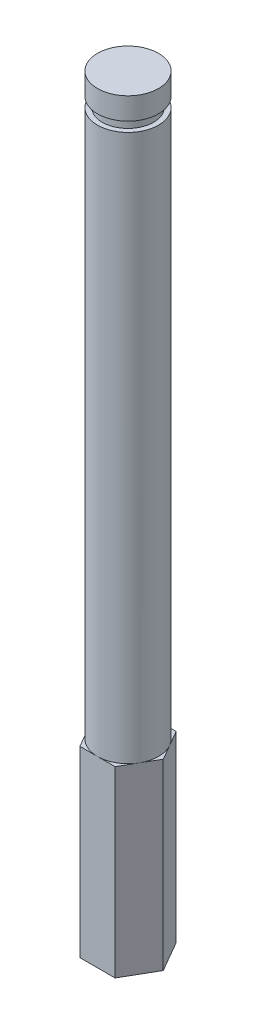
from build123d import *

# Parameters (mm, degrees)
BOSS_EXTRUDE1_DEPTH = 19.05
SKETCH2_R           = 3.175
BOSS_EXTRUDE2_DEPTH = 56.896
SKETCH3_R           = 2.667
BOSS_EXTRUDE3_DEPTH = 1.016
SKETCH4_R           = 3.175
BOSS_EXTRUDE4_DEPTH = 2.286


with BuildPart() as part:
    # Sketch1 → Boss-Extrude1 (new body)
    with BuildSketch(Plane(origin=(0, 0, 0), x_dir=(1, 0, 0), z_dir=(0, 1, 0))):
        Polygon((1.833087105, 3.175), (-1.833087105, 3.175), (-3.666174209, 0), (-1.833087105, -3.175), (1.833087105, -3.175), (3.666174209, 0), align=None)
    extrude(amount=BOSS_EXTRUDE1_DEPTH)

    # Sketch2 → Boss-Extrude2 (add)
    with BuildSketch(Plane(origin=(0, 19.05, 0), x_dir=(1, 0, 0), z_dir=(0, 1, 0))):
        with Locations(Location((0, 0, 0), (0, 0, 270))):
            Circle(SKETCH2_R)
    extrude(amount=BOSS_EXTRUDE2_DEPTH)

    # Sketch3 → Boss-Extrude3 (add)
    with BuildSketch(Plane(origin=(0, 75.946, 0), x_dir=(1, 0, 0), z_dir=(0, 1, 0))):
        with Locations(Location((0, 0, 0), (0, 0, 270))):
            Circle(SKETCH3_R)
    extrude(amount=BOSS_EXTRUDE3_DEPTH)

    # Sketch4 → Boss-Extrude4 (add)
    with BuildSketch(Plane(origin=(0, 76.962, 0), x_dir=(1, 0, 0), z_dir=(0, 1, 0))):
        with Locations(Location((0, 0, 0), (0, 0, 270))):
            Circle(SKETCH4_R)
    extrude(amount=BOSS_EXTRUDE4_DEPTH)


solid = part.part
